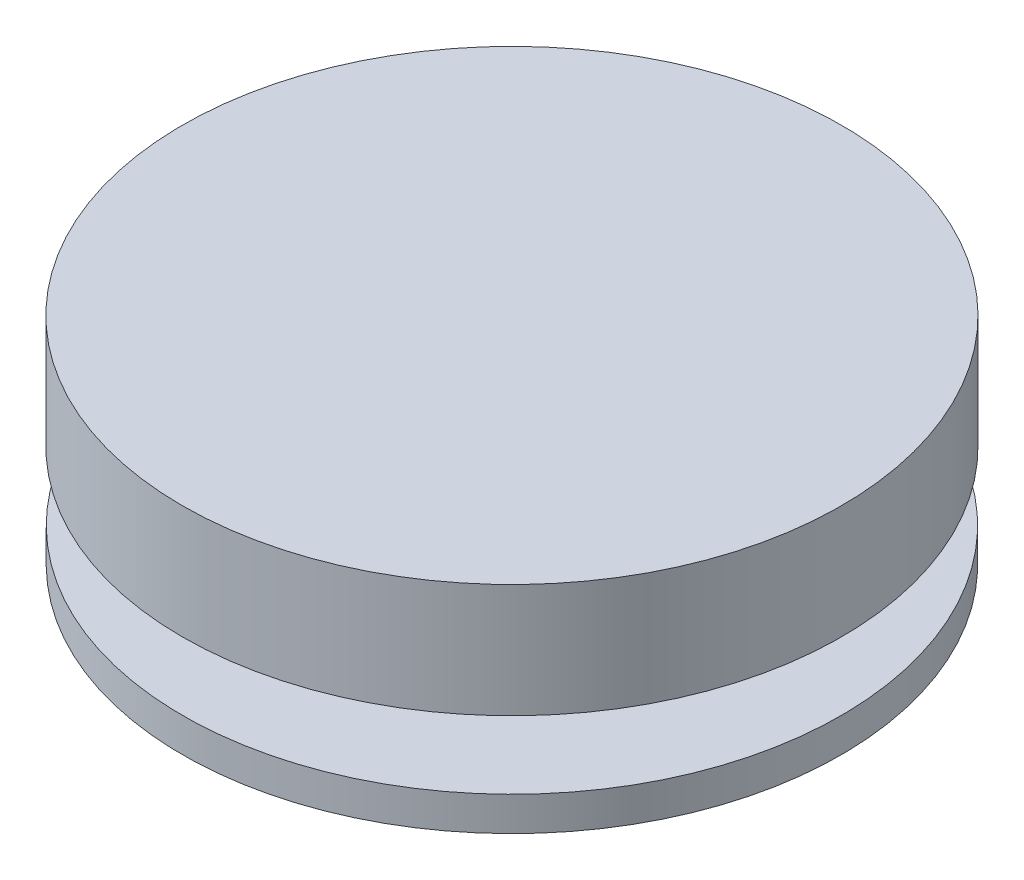
from build123d import *

# Parameters (mm, degrees)
SKETCH1_R           = 36.8
BOSS_EXTRUDE1_DEPTH = 3.81
SKETCH2_R           = 15.24
BOSS_EXTRUDE2_DEPTH = 7.62
SKETCH3_R           = 36.83
BOSS_EXTRUDE3_DEPTH = 12.7


with BuildPart() as part:
    # Sketch1 → Boss-Extrude1 (new body)
    with BuildSketch(Plane(origin=(0, 0, 0), x_dir=(1, 0, 0), z_dir=(0, 1, 0))):
        with Locations(Location((0, 0, 0), (0, 0, 90))):
            Circle(SKETCH1_R)
    extrude(amount=BOSS_EXTRUDE1_DEPTH)

    # Sketch2 → Boss-Extrude2 (add)
    with BuildSketch(Plane(origin=(0, 3.81, 0), x_dir=(1, 0, 0), z_dir=(0, 1, 0))):
        with Locations(Location((0, 0, 0), (0, 0, 90))):
            Circle(SKETCH2_R)
    extrude(amount=BOSS_EXTRUDE2_DEPTH)

    # Sketch3 → Boss-Extrude3 (add)
    with BuildSketch(Plane(origin=(0, 11.43, 0), x_dir=(1, 0, 0), z_dir=(0, 1, 0))):
        with Locations(Location((0, 0, 0), (0, 0, 270))):
            Circle(SKETCH3_R)
    extrude(amount=BOSS_EXTRUDE3_DEPTH)


solid = part.part
